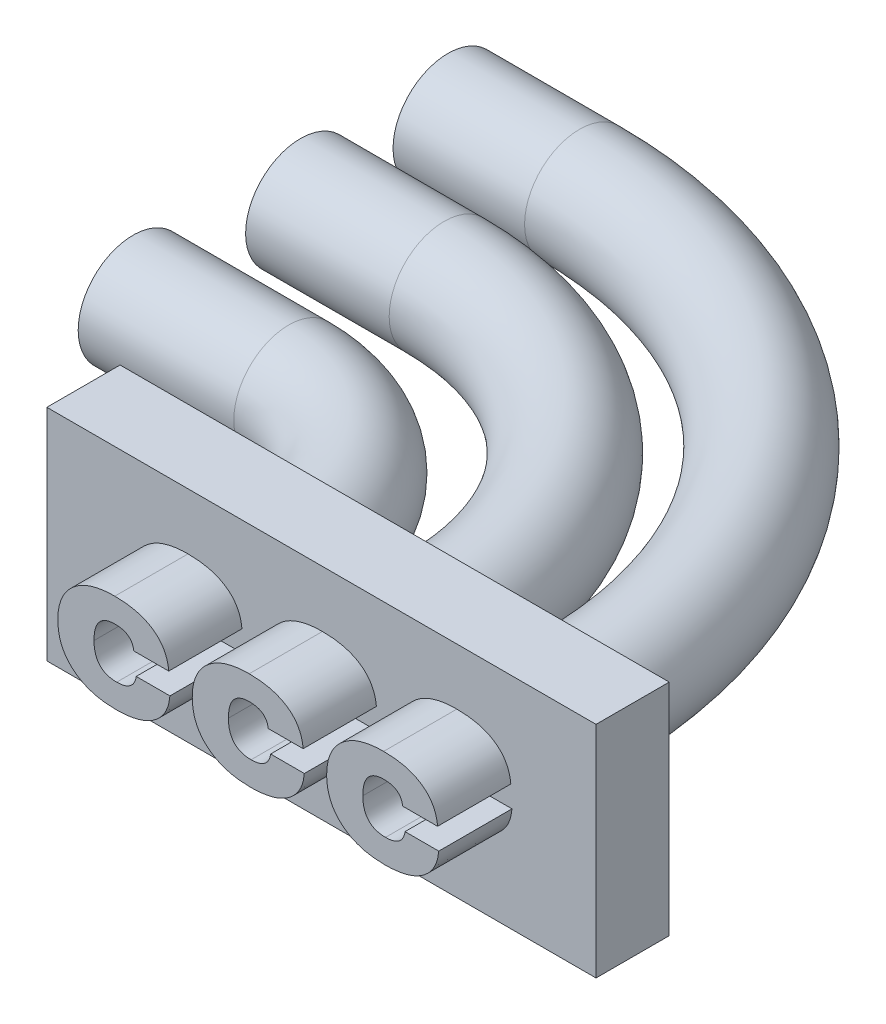
from build123d import *

# Parameters (mm, degrees)
SKETCH1_W           = 15
SKETCH1_H           = 6
BOSS_EXTRUDE1_DEPTH = 2
BOSS_EXTRUDE2_DEPTH = 2
SKETCH3_W           = 1.5
SKETCH3_H           = 4
BOSS_EXTRUDE3_DEPTH = 2
SKETCH12_W          = 14.1
SKETCH12_H          = 5
CUT_EXTRUDE1_DEPTH  = 21.804086224
SKETCH8_R           = 1.5
SKETCH7_R           = 1.5
SKETCH6_R           = 1.5


with BuildPart() as part:
    # Sketch1 → Boss-Extrude1 (new body)
    with BuildSketch(Plane.XY):
        Rectangle(SKETCH1_W, SKETCH1_H)
    extrude(amount=BOSS_EXTRUDE1_DEPTH)

    # Sketch2 → Boss-Extrude2 (add)
    with BuildSketch(Plane.XY.offset(2)):
        with BuildLine():
            Line((-3.060082731, -0.145888163), (-2.138122178, -0.145888163))
            add(Edge.make_bspline(
                [(-2.138122178, -0.145888163), (-2.142670856, -0.186817863), (-2.151591905, -0.267090827), (-2.177769169, -0.383345409), (-2.21581097, -0.492138159), (-2.263624462, -0.594453887), (-2.323094811, -0.689286262), (-2.393268208, -0.777226894), (-2.474496925, -0.857513187), (-2.56593251, -0.930702134), (-2.666921735, -0.996049335), (-2.776982197, -1.052595512), (-2.895454873, -1.100578301), (-3.022533127, -1.139544776), (-3.158112272, -1.169766838), (-3.302219404, -1.190920315), (-3.454592079, -1.204838445), (-3.559102892, -1.206109201), (-3.612641679, -1.206760184)],
                knots=[0, 0, 0, 0, 0.976829506, 1.915797078, 2.820653329, 3.707285315, 4.590388637, 5.470720937, 6.371504049, 7.295059075, 8.245589783, 9.221265507, 10.22720936, 11.275107911, 12.372107559, 13.52041678, 14.729759393, 16, 16, 16, 16], degree=3))
            add(Edge.make_bspline(
                [(-3.612641679, -1.206760184), (-3.672703037, -1.205681875), (-3.78980194, -1.203579545), (-3.960409691, -1.187028741), (-4.121131552, -1.159524222), (-4.272151379, -1.120467746), (-4.41338954, -1.070117311), (-4.545018014, -1.008999239), (-4.666052683, -0.9357143), (-4.759428604, -0.866298777), (-4.827861299, -0.80519677), (-4.876126049, -0.757629416), (-4.920907868, -0.707879294), (-4.961799812, -0.655502017), (-5.001017469, -0.602324328), (-5.03520084, -0.545835782), (-5.066531819, -0.487757573), (-5.095227297, -0.427867871), (-5.119706435, -0.365492075), (-5.141169611, -0.301230601), (-5.160246588, -0.235142926), (-5.173972983, -0.16652574), (-5.186283094, -0.096102513), (-5.194098935, -0.023574116), (-5.199662301, 0.050901618), (-5.200117214, 0.101226019), (-5.200348302, 0.126789902)],
                knots=[0, 0, 0, 0, 1.844349952, 3.595845402, 5.258382034, 6.847576437, 8.380255859, 9.857610627, 11.296535068, 12.718617156, 13.423703043, 14.112710587, 14.79899505, 15.477617194, 16.152961149, 16.826845299, 17.503194887, 18.179359879, 18.864977055, 19.559518563, 20.259847437, 20.975709944, 21.707382985, 22.454791923, 23.215062313, 24, 24, 24, 24], degree=3))
            add(Edge.make_bspline(
                [(-5.200348302, 0.126789902), (-5.20010237, 0.152180931), (-5.199614969, 0.202502272), (-5.194209089, 0.276824794), (-5.186092921, 0.349110093), (-5.174639319, 0.419303704), (-5.16060764, 0.487612395), (-5.142177766, 0.553751295), (-5.121526835, 0.618038985), (-5.096362936, 0.679989613), (-5.06892589, 0.74011142), (-5.037645758, 0.797974151), (-5.003916141, 0.854253903), (-4.966122932, 0.908133198), (-4.925686325, 0.960385835), (-4.880950125, 1.009688803), (-4.833769122, 1.057627908), (-4.766340776, 1.11879755), (-4.675008641, 1.189066666), (-4.555365546, 1.261581715), (-4.426723513, 1.323905616), (-4.288155058, 1.373282632), (-4.140527998, 1.412584115), (-3.983451282, 1.440688501), (-3.816730635, 1.457118665), (-3.702542629, 1.459248516), (-3.644025381, 1.460339989)],
                knots=[0, 0, 0, 0, 0.788949478, 1.563583616, 2.314590912, 3.048845008, 3.773225905, 4.480463959, 5.181590848, 5.870415235, 6.557195353, 7.234374924, 7.913502193, 8.595071886, 9.278472863, 9.965397725, 10.662604099, 11.368153272, 12.793402362, 14.235777976, 15.708930775, 17.227954371, 18.799982801, 20.451742852, 22.181645754, 24, 24, 24, 24], degree=3))
            add(Edge.make_bspline(
                [(-3.644025381, 1.460339989), (-3.590145407, 1.459654041), (-3.484967955, 1.458315025), (-3.331779518, 1.444898309), (-3.187282445, 1.425014513), (-3.051742807, 1.395613017), (-2.925065251, 1.357757509), (-2.807100237, 1.311399315), (-2.697988088, 1.256802381), (-2.597921972, 1.19407992), (-2.507288128, 1.123496152), (-2.42730916, 1.045048752), (-2.357479614, 0.959432927), (-2.298872924, 0.866301097), (-2.249803372, 0.766268305), (-2.212782576, 0.658660702), (-2.184664141, 0.544165897), (-2.175657871, 0.464783504), (-2.17104934, 0.42416334)],
                knots=[0, 0, 0, 0, 1.289638031, 2.517463008, 3.678757242, 4.779638757, 5.834372698, 6.840786757, 7.810284887, 8.751219913, 9.663723068, 10.555058948, 11.427779484, 12.302574037, 13.183982208, 14.089056298, 15.022165429, 16, 16, 16, 16], degree=3))
            Line((-2.17104934, 0.42416334), (-3.125937056, 0.42416334))
            add(Edge.make_bspline(
                [(-3.125937056, 0.42416334), (-3.127887549, 0.43930189), (-3.131710048, 0.468969842), (-3.142040136, 0.511730167), (-3.155998966, 0.551467781), (-3.173017188, 0.588472211), (-3.193630284, 0.622418347), (-3.217560825, 0.653683148), (-3.244880123, 0.682137249), (-3.275932903, 0.70732909), (-3.310313405, 0.72961548), (-3.347848304, 0.749134153), (-3.388701646, 0.76557697), (-3.432765481, 0.77899212), (-3.480105092, 0.789183756), (-3.530681368, 0.796119849), (-3.584421185, 0.801027394), (-3.621376024, 0.801535064), (-3.640423973, 0.801796736)],
                knots=[0, 0, 0, 0, 1.02792653, 2.014490992, 2.957386111, 3.862121815, 4.753924626, 5.627574869, 6.51019678, 7.405362218, 8.315615775, 9.266619089, 10.251558014, 11.278704828, 12.366648388, 13.51059177, 14.716862994, 16, 16, 16, 16], degree=3))
            add(Edge.make_bspline(
                [(-3.640423973, 0.801796736), (-3.66359615, 0.801322385), (-3.708533487, 0.800402487), (-3.773695909, 0.792761593), (-3.834173486, 0.779391176), (-3.890254475, 0.760839723), (-3.942034126, 0.737056913), (-3.989624331, 0.708404931), (-4.032399456, 0.67383737), (-4.070628025, 0.634091204), (-4.104105801, 0.588767942), (-4.133882485, 0.538692432), (-4.157647598, 0.482571167), (-4.177808251, 0.421494548), (-4.193663959, 0.355071069), (-4.204784234, 0.283334137), (-4.211575895, 0.206324597), (-4.212207123, 0.153214936), (-4.212533423, 0.125760928)],
                knots=[0, 0, 0, 0, 1.096253294, 2.125941888, 3.09853747, 4.02234602, 4.9155674, 5.789561441, 6.643741359, 7.510358195, 8.391630331, 9.304611926, 10.260406741, 11.268901007, 12.345516153, 13.487518248, 14.70122137, 16, 16, 16, 16], degree=3))
            add(Edge.make_bspline(
                [(-4.212533423, 0.125760928), (-4.212023732, 0.098820004), (-4.211034896, 0.046552836), (-4.20387538, -0.029304282), (-4.191745473, -0.100083864), (-4.174082766, -0.165772241), (-4.152269564, -0.226559049), (-4.125261299, -0.282308092), (-4.09338658, -0.333065066), (-4.056054059, -0.378504224), (-4.014296197, -0.419012114), (-3.96742428, -0.453622328), (-3.91626571, -0.483220184), (-3.860158566, -0.506780196), (-3.799647084, -0.525328362), (-3.73468148, -0.538434558), (-3.665177261, -0.547030055), (-3.617299342, -0.547812765), (-3.592576689, -0.548216932)],
                knots=[0, 0, 0, 0, 1.234472244, 2.394957414, 3.488022233, 4.52125041, 5.508253929, 6.443198368, 7.354559284, 8.248126489, 9.131859273, 10.013633023, 10.911406571, 11.833948595, 12.795981492, 13.807064445, 14.867636965, 16, 16, 16, 16], degree=3))
            add(Edge.make_bspline(
                [(-3.592576689, -0.548216932), (-3.573523043, -0.548008488), (-3.53637073, -0.547602048), (-3.482331036, -0.541902553), (-3.431051927, -0.534930223), (-3.383278569, -0.522562968), (-3.338007293, -0.508440572), (-3.295951089, -0.490511601), (-3.256998066, -0.469088819), (-3.220875063, -0.445176153), (-3.188314834, -0.417525473), (-3.158686185, -0.387396389), (-3.133666577, -0.353410241), (-3.111160748, -0.317572759), (-3.093383205, -0.278451413), (-3.078216775, -0.23709906), (-3.066824033, -0.192623437), (-3.06236613, -0.161718235), (-3.060082731, -0.145888163)],
                knots=[0, 0, 0, 0, 1.233312579, 2.404810797, 3.516940584, 4.580999436, 5.596108869, 6.586365755, 7.535726907, 8.472201243, 9.38661427, 10.29778373, 11.201885539, 12.11434029, 13.033597211, 13.978725792, 14.964675429, 16, 16, 16, 16], degree=3))
        make_face()
        with BuildLine():
            Line((0.611295902, -0.145888163), (1.533256455, -0.145888163))
            add(Edge.make_bspline(
                [(1.533256455, -0.145888163), (1.528707777, -0.186817863), (1.519786728, -0.267090827), (1.493609464, -0.383345409), (1.455567663, -0.492138159), (1.407754171, -0.594453887), (1.348283822, -0.689286262), (1.278110424, -0.777226894), (1.196881708, -0.857513187), (1.105446123, -0.930702134), (1.004456897, -0.996049335), (0.894396436, -1.052595512), (0.775923759, -1.100578301), (0.648845506, -1.139544776), (0.51326636, -1.169766838), (0.369159229, -1.190920315), (0.216786554, -1.204838445), (0.112275741, -1.206109201), (0.058736954, -1.206760184)],
                knots=[0, 0, 0, 0, 0.976829506, 1.915797078, 2.820653329, 3.707285315, 4.590388637, 5.470720937, 6.371504049, 7.295059075, 8.245589783, 9.221265507, 10.22720936, 11.275107911, 12.372107559, 13.52041678, 14.729759393, 16, 16, 16, 16], degree=3))
            add(Edge.make_bspline(
                [(0.058736954, -1.206760184), (-0.001324404, -1.205681875), (-0.118423307, -1.203579545), (-0.289031058, -1.187028741), (-0.449752919, -1.159524222), (-0.600772746, -1.120467746), (-0.742010907, -1.070117311), (-0.873639381, -1.008999239), (-0.99467405, -0.9357143), (-1.088049971, -0.866298777), (-1.156482666, -0.80519677), (-1.204747416, -0.757629416), (-1.249529235, -0.707879294), (-1.290421179, -0.655502017), (-1.329638836, -0.602324328), (-1.363822207, -0.545835782), (-1.395153186, -0.487757573), (-1.423848664, -0.427867871), (-1.448327802, -0.365492075), (-1.469790978, -0.301230601), (-1.488867955, -0.235142926), (-1.50259435, -0.16652574), (-1.514904461, -0.096102513), (-1.522720303, -0.023574116), (-1.528283668, 0.050901618), (-1.528738581, 0.101226019), (-1.528969669, 0.126789902)],
                knots=[0, 0, 0, 0, 1.844349952, 3.595845402, 5.258382034, 6.847576437, 8.380255859, 9.857610627, 11.296535068, 12.718617156, 13.423703043, 14.112710587, 14.79899505, 15.477617194, 16.152961149, 16.826845299, 17.503194887, 18.179359879, 18.864977055, 19.559518563, 20.259847437, 20.975709944, 21.707382985, 22.454791923, 23.215062313, 24, 24, 24, 24], degree=3))
            add(Edge.make_bspline(
                [(-1.528969669, 0.126789902), (-1.528723737, 0.152180931), (-1.528236336, 0.202502272), (-1.522830456, 0.276824794), (-1.514714289, 0.349110093), (-1.503260687, 0.419303704), (-1.489229007, 0.487612395), (-1.470799133, 0.553751295), (-1.450148202, 0.618038985), (-1.424984304, 0.679989613), (-1.397547257, 0.74011142), (-1.366267126, 0.797974151), (-1.332537508, 0.854253903), (-1.294744299, 0.908133198), (-1.254307692, 0.960385835), (-1.209571492, 1.009688803), (-1.162390489, 1.057627908), (-1.094962143, 1.11879755), (-1.003630008, 1.189066666), (-0.883986913, 1.261581715), (-0.75534488, 1.323905616), (-0.616776425, 1.373282632), (-0.469149365, 1.412584115), (-0.312072649, 1.440688501), (-0.145352002, 1.457118665), (-0.031163997, 1.459248516), (0.027353252, 1.460339989)],
                knots=[0, 0, 0, 0, 0.788949478, 1.563583616, 2.314590912, 3.048845008, 3.773225905, 4.480463959, 5.181590848, 5.870415235, 6.557195353, 7.234374924, 7.913502193, 8.595071886, 9.278472863, 9.965397725, 10.662604099, 11.368153272, 12.793402362, 14.235777976, 15.708930775, 17.227954371, 18.799982801, 20.451742852, 22.181645754, 24, 24, 24, 24], degree=3))
            add(Edge.make_bspline(
                [(0.027353252, 1.460339989), (0.081233226, 1.459654041), (0.186410678, 1.458315025), (0.339599115, 1.444898309), (0.484096188, 1.425014513), (0.619635826, 1.395613017), (0.746313382, 1.357757509), (0.864278396, 1.311399315), (0.973390545, 1.256802381), (1.073456661, 1.19407992), (1.164090505, 1.123496152), (1.244069473, 1.045048752), (1.313899019, 0.959432927), (1.372505709, 0.866301097), (1.421575261, 0.766268305), (1.458596057, 0.658660702), (1.486714492, 0.544165897), (1.495720762, 0.464783504), (1.500329293, 0.42416334)],
                knots=[0, 0, 0, 0, 1.289638031, 2.517463008, 3.678757242, 4.779638757, 5.834372698, 6.840786757, 7.810284887, 8.751219913, 9.663723068, 10.555058948, 11.427779484, 12.302574037, 13.183982208, 14.089056298, 15.022165429, 16, 16, 16, 16], degree=3))
            Line((1.500329293, 0.42416334), (0.545441576, 0.42416334))
            add(Edge.make_bspline(
                [(0.545441576, 0.42416334), (0.543491084, 0.43930189), (0.539668585, 0.468969842), (0.529338497, 0.511730167), (0.515379666, 0.551467781), (0.498361445, 0.588472211), (0.477748349, 0.622418347), (0.453817808, 0.653683148), (0.42649851, 0.682137249), (0.39544573, 0.70732909), (0.361065228, 0.72961548), (0.323530328, 0.749134153), (0.282676987, 0.76557697), (0.238613151, 0.77899212), (0.191273541, 0.789183756), (0.140697265, 0.796119849), (0.086957447, 0.801027394), (0.050002609, 0.801535064), (0.03095466, 0.801796736)],
                knots=[0, 0, 0, 0, 1.02792653, 2.014490992, 2.957386111, 3.862121815, 4.753924626, 5.627574869, 6.51019678, 7.405362218, 8.315615775, 9.266619089, 10.251558014, 11.278704828, 12.366648388, 13.51059177, 14.716862994, 16, 16, 16, 16], degree=3))
            add(Edge.make_bspline(
                [(0.03095466, 0.801796736), (0.007782483, 0.801322385), (-0.037154854, 0.800402487), (-0.102317276, 0.792761593), (-0.162794853, 0.779391176), (-0.218875842, 0.760839723), (-0.270655493, 0.737056913), (-0.318245698, 0.708404931), (-0.361020823, 0.67383737), (-0.399249392, 0.634091204), (-0.432727168, 0.588767942), (-0.462503853, 0.538692432), (-0.486268965, 0.482571167), (-0.506429618, 0.421494548), (-0.522285326, 0.355071069), (-0.533405601, 0.283334137), (-0.540197262, 0.206324597), (-0.54082849, 0.153214936), (-0.54115479, 0.125760928)],
                knots=[0, 0, 0, 0, 1.096253294, 2.125941888, 3.09853747, 4.02234602, 4.9155674, 5.789561441, 6.643741359, 7.510358195, 8.391630331, 9.304611926, 10.260406741, 11.268901007, 12.345516153, 13.487518248, 14.70122137, 16, 16, 16, 16], degree=3))
            add(Edge.make_bspline(
                [(-0.54115479, 0.125760928), (-0.540645099, 0.098820004), (-0.539656263, 0.046552836), (-0.532496747, -0.029304282), (-0.52036684, -0.100083864), (-0.502704133, -0.165772241), (-0.480890931, -0.226559049), (-0.453882667, -0.282308092), (-0.422007947, -0.333065066), (-0.384675426, -0.378504224), (-0.342917564, -0.419012114), (-0.296045647, -0.453622328), (-0.244887077, -0.483220184), (-0.188779933, -0.506780196), (-0.128268451, -0.525328362), (-0.063302847, -0.538434558), (0.006201372, -0.547030055), (0.054079291, -0.547812765), (0.078801944, -0.548216932)],
                knots=[0, 0, 0, 0, 1.234472244, 2.394957414, 3.488022233, 4.52125041, 5.508253929, 6.443198368, 7.354559284, 8.248126489, 9.131859273, 10.013633023, 10.911406571, 11.833948595, 12.795981492, 13.807064445, 14.867636965, 16, 16, 16, 16], degree=3))
            add(Edge.make_bspline(
                [(0.078801944, -0.548216932), (0.09785559, -0.548008488), (0.135007902, -0.547602048), (0.189047596, -0.541902553), (0.240326706, -0.534930223), (0.288100063, -0.522562968), (0.33337134, -0.508440572), (0.375427544, -0.490511601), (0.414380567, -0.469088819), (0.45050357, -0.445176153), (0.483063798, -0.417525473), (0.512692448, -0.387396389), (0.537712056, -0.353410241), (0.560217885, -0.317572759), (0.577995428, -0.278451413), (0.593161858, -0.23709906), (0.6045546, -0.192623437), (0.609012502, -0.161718235), (0.611295902, -0.145888163)],
                knots=[0, 0, 0, 0, 1.233312579, 2.404810797, 3.516940584, 4.580999436, 5.596108869, 6.586365755, 7.535726907, 8.472201243, 9.38661427, 10.29778373, 11.201885539, 12.11434029, 13.033597211, 13.978725792, 14.964675429, 16, 16, 16, 16], degree=3))
        make_face()
        with BuildLine():
            Line((4.282674535, -0.145888163), (5.204635088, -0.145888163))
            add(Edge.make_bspline(
                [(5.204635088, -0.145888163), (5.20008641, -0.186817863), (5.191165361, -0.267090827), (5.164988097, -0.383345409), (5.126946296, -0.492138159), (5.079132804, -0.594453887), (5.019662455, -0.689286262), (4.949489057, -0.777226894), (4.868260341, -0.857513187), (4.776824756, -0.930702134), (4.67583553, -0.996049335), (4.565775069, -1.052595512), (4.447302392, -1.100578301), (4.320224139, -1.139544776), (4.184644993, -1.169766838), (4.040537862, -1.190920315), (3.888165187, -1.204838445), (3.783654374, -1.206109201), (3.730115587, -1.206760184)],
                knots=[0, 0, 0, 0, 0.976829506, 1.915797078, 2.820653329, 3.707285315, 4.590388637, 5.470720937, 6.371504049, 7.295059075, 8.245589783, 9.221265507, 10.22720936, 11.275107911, 12.372107559, 13.52041678, 14.729759393, 16, 16, 16, 16], degree=3))
            add(Edge.make_bspline(
                [(3.730115587, -1.206760184), (3.670054229, -1.205681875), (3.552955326, -1.203579545), (3.382347575, -1.187028741), (3.221625714, -1.159524222), (3.070605887, -1.120467746), (2.929367726, -1.070117311), (2.797739252, -1.008999239), (2.676704583, -0.9357143), (2.583328662, -0.866298777), (2.514895967, -0.80519677), (2.466631217, -0.757629416), (2.421849398, -0.707879294), (2.380957454, -0.655502017), (2.341739797, -0.602324328), (2.307556425, -0.545835782), (2.276225447, -0.487757573), (2.247529968, -0.427867871), (2.223050831, -0.365492075), (2.201587655, -0.301230601), (2.182510678, -0.235142926), (2.168784283, -0.16652574), (2.156474172, -0.096102513), (2.14865833, -0.023574116), (2.143094965, 0.050901618), (2.142640052, 0.101226019), (2.142408964, 0.126789902)],
                knots=[0, 0, 0, 0, 1.844349952, 3.595845402, 5.258382034, 6.847576437, 8.380255859, 9.857610627, 11.296535068, 12.718617156, 13.423703043, 14.112710587, 14.79899505, 15.477617194, 16.152961149, 16.826845299, 17.503194887, 18.179359879, 18.864977055, 19.559518563, 20.259847437, 20.975709944, 21.707382985, 22.454791923, 23.215062313, 24, 24, 24, 24], degree=3))
            add(Edge.make_bspline(
                [(2.142408964, 0.126789902), (2.142654896, 0.152180931), (2.143142297, 0.202502272), (2.148548177, 0.276824794), (2.156664344, 0.349110093), (2.168117946, 0.419303704), (2.182149625, 0.487612395), (2.2005795, 0.553751295), (2.221230431, 0.618038985), (2.246394329, 0.679989613), (2.273831375, 0.74011142), (2.305111507, 0.797974151), (2.338841125, 0.854253903), (2.376634334, 0.908133198), (2.417070941, 0.960385835), (2.461807141, 1.009688803), (2.508988144, 1.057627908), (2.57641649, 1.11879755), (2.667748625, 1.189066666), (2.78739172, 1.261581715), (2.916033753, 1.323905616), (3.054602208, 1.373282632), (3.202229268, 1.412584115), (3.359305984, 1.440688501), (3.52602663, 1.457118665), (3.640214636, 1.459248516), (3.698731885, 1.460339989)],
                knots=[0, 0, 0, 0, 0.788949478, 1.563583616, 2.314590912, 3.048845008, 3.773225905, 4.480463959, 5.181590848, 5.870415235, 6.557195353, 7.234374924, 7.913502193, 8.595071886, 9.278472863, 9.965397725, 10.662604099, 11.368153272, 12.793402362, 14.235777976, 15.708930775, 17.227954371, 18.799982801, 20.451742852, 22.181645754, 24, 24, 24, 24], degree=3))
            add(Edge.make_bspline(
                [(3.698731885, 1.460339989), (3.752611859, 1.459654041), (3.857789311, 1.458315025), (4.010977748, 1.444898309), (4.155474821, 1.425014513), (4.291014459, 1.395613017), (4.417692015, 1.357757509), (4.535657029, 1.311399315), (4.644769178, 1.256802381), (4.744835294, 1.19407992), (4.835469138, 1.123496152), (4.915448106, 1.045048752), (4.985277651, 0.959432927), (5.043884342, 0.866301097), (5.092953894, 0.766268305), (5.12997469, 0.658660702), (5.158093125, 0.544165897), (5.167099395, 0.464783504), (5.171707925, 0.42416334)],
                knots=[0, 0, 0, 0, 1.289638031, 2.517463008, 3.678757242, 4.779638757, 5.834372698, 6.840786757, 7.810284887, 8.751219913, 9.663723068, 10.555058948, 11.427779484, 12.302574037, 13.183982208, 14.089056298, 15.022165429, 16, 16, 16, 16], degree=3))
            Line((5.171707925, 0.42416334), (4.216820209, 0.42416334))
            add(Edge.make_bspline(
                [(4.216820209, 0.42416334), (4.214869717, 0.43930189), (4.211047218, 0.468969842), (4.20071713, 0.511730167), (4.186758299, 0.551467781), (4.169740078, 0.588472211), (4.149126982, 0.622418347), (4.125196441, 0.653683148), (4.097877142, 0.682137249), (4.066824363, 0.70732909), (4.032443861, 0.72961548), (3.994908961, 0.749134153), (3.95405562, 0.76557697), (3.909991784, 0.77899212), (3.862652174, 0.789183756), (3.812075898, 0.796119849), (3.75833608, 0.801027394), (3.721381242, 0.801535064), (3.702333293, 0.801796736)],
                knots=[0, 0, 0, 0, 1.02792653, 2.014490992, 2.957386111, 3.862121815, 4.753924626, 5.627574869, 6.51019678, 7.405362218, 8.315615775, 9.266619089, 10.251558014, 11.278704828, 12.366648388, 13.51059177, 14.716862994, 16, 16, 16, 16], degree=3))
            add(Edge.make_bspline(
                [(3.702333293, 0.801796736), (3.679161115, 0.801322385), (3.634223779, 0.800402487), (3.569061357, 0.792761593), (3.50858378, 0.779391176), (3.452502791, 0.760839723), (3.400723139, 0.737056913), (3.353132935, 0.708404931), (3.31035781, 0.67383737), (3.272129241, 0.634091204), (3.238651465, 0.588767942), (3.20887478, 0.538692432), (3.185109668, 0.482571167), (3.164949015, 0.421494548), (3.149093307, 0.355071069), (3.137973032, 0.283334137), (3.13118137, 0.206324597), (3.130550143, 0.153214936), (3.130223843, 0.125760928)],
                knots=[0, 0, 0, 0, 1.096253294, 2.125941888, 3.09853747, 4.02234602, 4.9155674, 5.789561441, 6.643741359, 7.510358195, 8.391630331, 9.304611926, 10.260406741, 11.268901007, 12.345516153, 13.487518248, 14.70122137, 16, 16, 16, 16], degree=3))
            add(Edge.make_bspline(
                [(3.130223843, 0.125760928), (3.130733534, 0.098820004), (3.131722369, 0.046552836), (3.138881885, -0.029304282), (3.151011793, -0.100083864), (3.1686745, -0.165772241), (3.190487702, -0.226559049), (3.217495966, -0.282308092), (3.249370686, -0.333065066), (3.286703207, -0.378504224), (3.328461069, -0.419012114), (3.375332985, -0.453622328), (3.426491556, -0.483220184), (3.4825987, -0.506780196), (3.543110182, -0.525328362), (3.608075786, -0.538434558), (3.677580005, -0.547030055), (3.725457923, -0.547812765), (3.750180576, -0.548216932)],
                knots=[0, 0, 0, 0, 1.234472244, 2.394957414, 3.488022233, 4.52125041, 5.508253929, 6.443198368, 7.354559284, 8.248126489, 9.131859273, 10.013633023, 10.911406571, 11.833948595, 12.795981492, 13.807064445, 14.867636965, 16, 16, 16, 16], degree=3))
            add(Edge.make_bspline(
                [(3.750180576, -0.548216932), (3.769234223, -0.548008488), (3.806386535, -0.547602048), (3.860426229, -0.541902553), (3.911705338, -0.534930223), (3.959478696, -0.522562968), (4.004749973, -0.508440572), (4.046806177, -0.490511601), (4.0857592, -0.469088819), (4.121882203, -0.445176153), (4.154442431, -0.417525473), (4.184071081, -0.387396389), (4.209090689, -0.353410241), (4.231596518, -0.317572759), (4.249374061, -0.278451413), (4.264540491, -0.23709906), (4.275933233, -0.192623437), (4.280391135, -0.161718235), (4.282674535, -0.145888163)],
                knots=[0, 0, 0, 0, 1.233312579, 2.404810797, 3.516940584, 4.580999436, 5.596108869, 6.586365755, 7.535726907, 8.472201243, 9.38661427, 10.29778373, 11.201885539, 12.11434029, 13.033597211, 13.978725792, 14.964675429, 16, 16, 16, 16], degree=3))
        make_face()
    extrude(amount=BOSS_EXTRUDE2_DEPTH)

    # Sketch3 → Boss-Extrude3 (add, symmetric)
    with BuildSketch(Plane(origin=(0, 0, 0), x_dir=(1, 0, 0), z_dir=(0, 1, 0))):
        Polygon((2.948731885, 0), (4.448731885, 0), (4.448731885, 14.1), (-2.422646748, 14.1), (-2.422646748, 12.6), (2.948731885, 12.6), align=None)
        with Locations((-3.644025381, 2)):
            Rectangle(SKETCH3_W, SKETCH3_H)
        Polygon((-0.722646748, 0), (0.777353252, 0), (0.777353252, 10.1), (-2.422646748, 10.1), (-2.422646748, 8.6), (-0.722646748, 8.6), align=None)
    extrude(amount=BOSS_EXTRUDE3_DEPTH, both=True)

    # Sketch12 → Cut-Extrude1 (cut, through all)
    with BuildSketch(Plane(origin=(7.5, 0, 0), x_dir=(0, 0, -1), z_dir=(1, 0, 0))):
        with Locations((7.05, -0.5)):
            Rectangle(SKETCH12_W, SKETCH12_H)
    extrude(amount=-CUT_EXTRUDE1_DEPTH, mode=Mode.SUBTRACT)

    # Sweep1: sweep along a path in Sketch9
    with BuildLine(Plane(origin=(0, 0, 0), x_dir=(1, 0, 0), z_dir=(0, 1, 0))) as sweep1_path:
        Line((-3.644025381, 0), (-3.644025381, 0.75))
        ThreePointArc((-3.644025381, 0.75), (-4.815598256, 3.578427125), (-7.644025381, 4.75))
        Line((-7.644025381, 4.75), (-11.894025381, 4.75))
    # Sketch8 → Sweep1 (sweep)
    with BuildSketch(Plane(origin=(0, 0, 0), x_dir=(-1, 0, 0), z_dir=(0, 0, -1))):
        with Locations((3.644025381, 0)):
            Circle(SKETCH8_R)
    sweep(path=sweep1_path.line)

    # Sweep2: sweep along a path in Sketch10
    with BuildLine(Plane(origin=(0, 0, 0), x_dir=(1, 0, 0), z_dir=(0, 1, 0))) as sweep2_path:
        Line((0.027353252, 0), (0.027353252, 1.35))
        ThreePointArc((0.027353252, 1.35), (-2.315792499, 7.006854249), (-7.972646748, 9.35))
        Line((-7.972646748, 9.35), (-11.894025381, 9.35))
    # Sketch7 → Sweep2 (sweep)
    with BuildSketch(Plane(origin=(0, 0, 0), x_dir=(-1, 0, 0), z_dir=(0, 0, -1))):
        Circle(SKETCH7_R)
    sweep(path=sweep2_path.line)

    # Sweep3: sweep along a path in Sketch11
    with BuildLine(Plane(origin=(0, 0, 0), x_dir=(1, 0, 0), z_dir=(0, 1, 0))) as sweep3_path:
        Line((3.698731885, 0), (3.698731885, 1.35))
        ThreePointArc((3.698731885, 1.35), (0.184013259, 9.835281374), (-8.301268115, 13.35))
        Line((-8.301268115, 13.35), (-11.894025381, 13.35))
    # Sketch6 → Sweep3 (sweep)
    with BuildSketch(Plane(origin=(0, 0, 0), x_dir=(-1, 0, 0), z_dir=(0, 0, -1))):
        with Locations((-3.698731885, 0)):
            Circle(SKETCH6_R)
    sweep(path=sweep3_path.line)


solid = part.part
